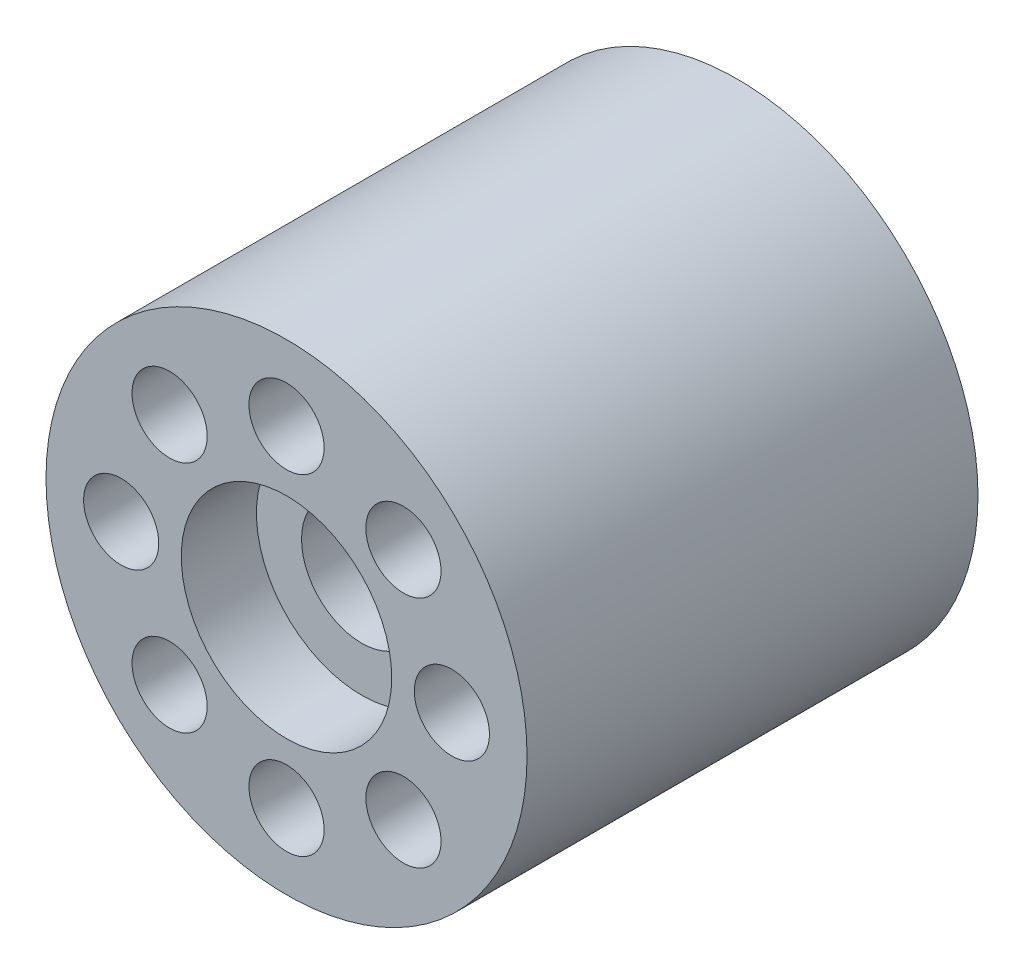
from build123d import *

# Parameters (mm, degrees)
SKETCH_1_R               = 16
SKETCH_1_R_2             = 4
EXTRUDE_1_DEPTH          = 10
SKETCH_2_R               = 2.5
CUT_EXTRUDE_1_DEPTH      = 20
PATTERN_CIRCULAR_1_COUNT = 8
SKETCH_3_R               = 7
CUT_EXTRUDE_2_DEPTH      = 5
SKETCH_4_R               = 6
CUT_EXTRUDE_3_DEPTH      = 1
EXTRUDE_START            = 20
SKETCH_5_R               = 16
SKETCH_5_R_2             = 14
EXTRUDE_2_DEPTH          = 20


with BuildPart() as part:
    # 스케치1 → 보스-돌출1 (new body)
    with BuildSketch(Plane.XY):
        Circle(SKETCH_1_R)
        Circle(SKETCH_1_R_2, mode=Mode.SUBTRACT)
    extrude(amount=EXTRUDE_1_DEPTH)

    # 스케치2 → 컷-돌출1 (cut)
    with BuildSketch(Plane.XY):
        with Locations((0, 11)):
            Circle(SKETCH_2_R)
    cut_extrude_1 = extrude(amount=CUT_EXTRUDE_1_DEPTH, mode=Mode.SUBTRACT)

    # 원형 패턴1: 컷-돌출1 ×8 about axis
    pattern_circular_1_axis = Axis((0, 0, 0), (0, 0, 1))
    for i in range(1, PATTERN_CIRCULAR_1_COUNT):
        add(cut_extrude_1.rotate(pattern_circular_1_axis, i * 360 / PATTERN_CIRCULAR_1_COUNT), mode=Mode.SUBTRACT)

    # 스케치3 → 컷-돌출2 (cut)
    with BuildSketch(Plane.XY.offset(10)):
        Circle(SKETCH_3_R)
    extrude(amount=-CUT_EXTRUDE_2_DEPTH, mode=Mode.SUBTRACT)

    # 스케치4 → 컷-돌출3 (cut)
    with BuildSketch(Plane(origin=(0, 0, 0), x_dir=(-1, 0, 0), z_dir=(0, 0, -1))):
        Circle(SKETCH_4_R)
    extrude(amount=-CUT_EXTRUDE_3_DEPTH, mode=Mode.SUBTRACT)

    # 스케치5 → 보스-돌출2 (add)
    with BuildSketch(Plane(origin=(0, 0, 0), x_dir=(-1, 0, 0), z_dir=(0, 0, -1)).offset(EXTRUDE_START)):
        Circle(SKETCH_5_R)
        Circle(SKETCH_5_R_2, mode=Mode.SUBTRACT)
    extrude(amount=-EXTRUDE_2_DEPTH)

    # 스케치6 → 회전1 (revolve)
    with BuildSketch(Plane(origin=(0, 0, 0), x_dir=(0, 0, -1), z_dir=(1, 0, 0)), mode=Mode.PRIVATE) as revolve_1_sk:
        Polygon((20, 14), (20, 6.1), (9.414853381, 6.1), (0, 13.5), (0, 14), align=None)
    revolve(revolve_1_sk.sketch.rotate(Axis((0, 0, 0), (0, 0, -1)), 270), axis=Axis((0, 0, 0), (0, 0, -1)))


solid = part.part
